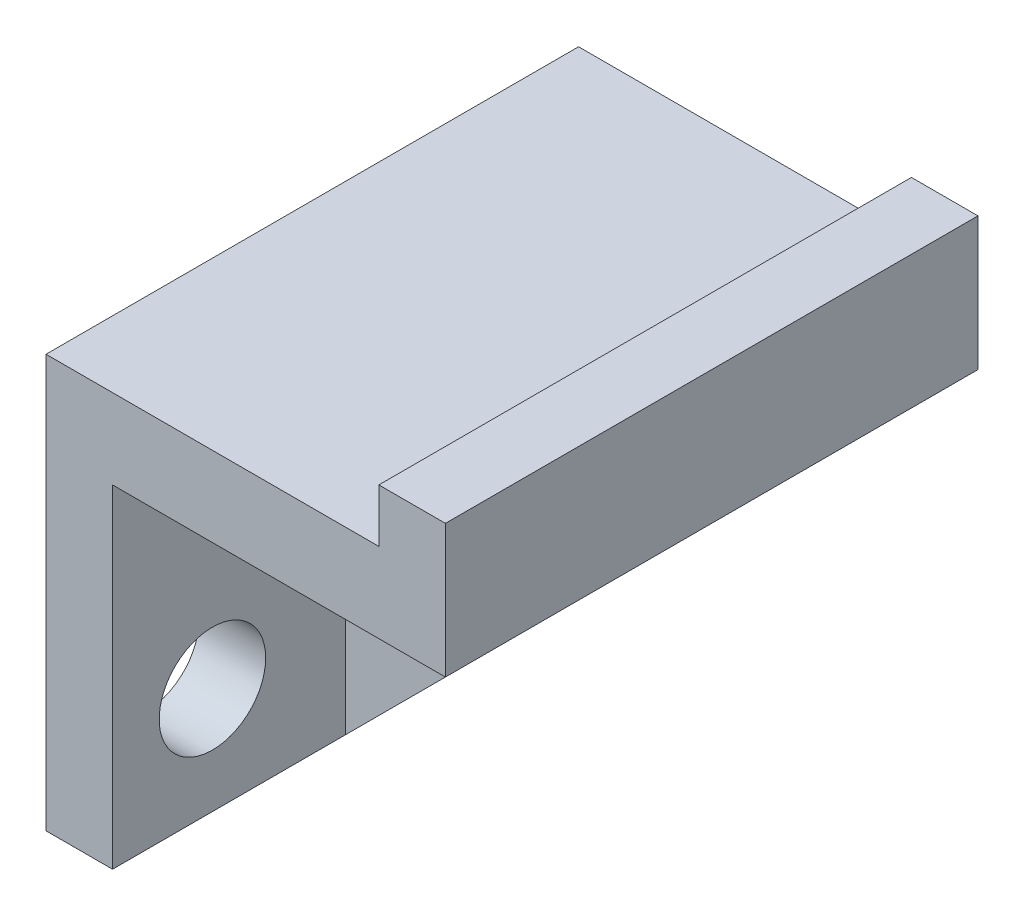
from build123d import *

# Parameters (mm, degrees)
BOSS_EXTRUDE1_DEPTH = 40000
SKETCH2_R           = 8000
CUT_EXTRUDE1_DEPTH  = 94869.329805051
BOSS_EXTRUDE2_START = -45000
BOSS_EXTRUDE2_DEPTH = 10000


with BuildPart() as part:
    # Sketch1 → Boss-Extrude1 (new, symmetric)
    with BuildSketch(Plane.XY):
        Polygon((0, 0), (10000, 0), (10000, 50000), (60000, 50000), (60000, 70000), (50000, 70000), (50000, 62000), (0, 62000), align=None)
    extrude(amount=BOSS_EXTRUDE1_DEPTH, both=True)

    # Sketch2 → Cut-Extrude1 (cut, through all)
    with BuildSketch(Plane(origin=(10000, 0, 0), x_dir=(0, 0, -1), z_dir=(1, 0, 0))):
        with Locations((-25000, 16000)):
            Circle(SKETCH2_R)
        with Locations((25000, 16000)):
            Circle(SKETCH2_R)
    extrude(amount=-CUT_EXTRUDE1_DEPTH, mode=Mode.SUBTRACT)

    # Sketch3 → Boss-Extrude2 (add)
    with BuildSketch(Plane.XY.offset(40000).offset(BOSS_EXTRUDE2_START)):
        Polygon((60000, 50000), (10000, 50000), (10000, 0), align=None)
    extrude(amount=BOSS_EXTRUDE2_DEPTH)


solid = part.part
